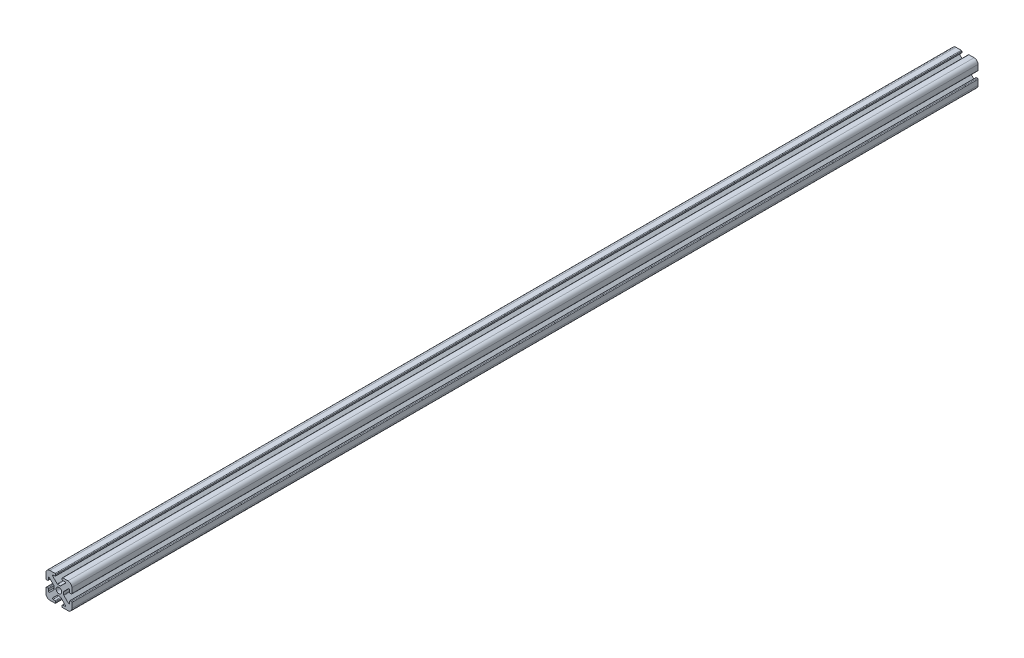
from build123d import *

# Parameters (mm, degrees)
SKETCH1_W           = 7.3
SKETCH1_H           = 7.3
SKETCH1_R           = 2.15
BOSS_EXTRUDE1_DEPTH = 700
BOSS_EXTRUDE2_DEPTH = 700
FILLET4_R           = 3
FILLET5_R           = 0.5
FILLET6_R           = 0.5
FILLET7_R           = 0.5
SKETCH3_R           = 2.15
CUT_EXTRUDE1_DEPTH  = 701.204486204
SKETCH4_R           = 2.15
CUT_EXTRUDE2_DEPTH  = 701.204486304
SKETCH5_R           = 2.15
CUT_EXTRUDE3_DEPTH  = 701.204486304
SKETCH6_R           = 2.15
CUT_EXTRUDE4_DEPTH  = 701.204486304


with BuildPart() as part:
    # Sketch1 → Boss-Extrude1 (new body)
    with BuildSketch(Plane.XY):
        Rectangle(SKETCH1_W, SKETCH1_H)
        Circle(SKETCH1_R, mode=Mode.SUBTRACT)
    extrude(amount=BOSS_EXTRUDE1_DEPTH)

    # Sketch2 → Boss-Extrude2 (add)
    with BuildSketch(Plane.XY):
        Polygon((3.65, 3.65), (1.2, 3.65), (5.750000001, 8.200000001), (2.500000001, 8.200000001), (2.500000001, 10.000000001), (10.000000001, 10.000000001), (10.000000001, 2.500000001), (8.200000001, 2.500000001), (8.200000001, 5.750000001), (3.65, 1.2), align=None)
        Polygon((-3.65, 3.65), (-1.2, 3.65), (-5.750000001, 8.200000001), (-2.500000001, 8.200000001), (-2.500000001, 10.000000001), (-10.000000001, 10.000000001), (-10.000000001, 2.500000001), (-8.200000001, 2.500000001), (-8.200000001, 5.750000001), (-3.65, 1.2), align=None)
        Polygon((-3.65, -3.65), (-3.65, -1.2), (-8.200000001, -5.750000001), (-8.200000001, -2.500000001), (-10.000000001, -2.500000001), (-10.000000001, -10.000000001), (-2.500000001, -10.000000001), (-2.500000001, -8.200000001), (-5.750000001, -8.200000001), (-1.2, -3.65), align=None)
        Polygon((3.65, -3.65), (3.65, -1.2), (8.200000001, -5.750000001), (8.200000001, -2.500000001), (10.000000001, -2.500000001), (10.000000001, -10.000000001), (2.500000001, -10.000000001), (2.500000001, -8.200000001), (5.750000001, -8.200000001), (1.2, -3.65), align=None)
    extrude(amount=BOSS_EXTRUDE2_DEPTH)

    # Fillet4
    fillet4_edges = [part.edges().sort_by_distance(p)[0] for p in [
        (10.000000001, 10.000000001, 350),
        (-10.000000001, 10.000000001, 350),
        (-10.000000001, -10.000000001, 350),
        (10.000000001, -10.000000001, 350),
    ]]
    fillet(fillet4_edges, radius=FILLET4_R)

    # Fillet5
    fillet5_edges = [part.edges().sort_by_distance(p)[0] for p in [
        (8.200000001, 2.500000001, 350),
        (10.000000001, 2.500000001, 350),
        (2.500000001, 10.000000001, 350),
        (2.500000001, 8.200000001, 350),
        (-2.500000001, 8.200000001, 350),
        (-2.500000001, 10.000000001, 350),
        (-10.000000001, 2.500000001, 350),
        (-8.200000001, 2.500000001, 350),
        (-8.200000001, -2.500000001, 350),
        (-10.000000001, -2.500000001, 350),
        (-2.500000001, -10.000000001, 350),
        (-2.500000001, -8.200000001, 350),
        (2.500000001, -8.200000001, 350),
        (10.000000001, -2.500000001, 350),
        (8.200000001, -2.500000001, 350),
    ]]
    fillet(fillet5_edges, radius=FILLET5_R)

    # Fillet6
    fillet6_edges = [part.edges().sort_by_distance(p)[0] for p in [
        (3.65, 1.2, 350),
        (1.2, 3.65, 350),
        (-3.65, 1.2, 350),
        (-1.2, 3.65, 350),
        (-1.2, -3.65, 350),
        (-3.65, -1.2, 350),
        (1.2, -3.65, 350),
        (3.65, -1.2, 350),
    ]]
    fillet(fillet6_edges, radius=FILLET6_R)

    # Fillet7
    fillet7_edges = [part.edges().sort_by_distance(p)[0] for p in [
        (8.200000001, 5.750000001, 350),
        (5.750000001, 8.200000001, 350),
        (-5.750000001, 8.200000001, 350),
        (-8.200000001, 5.750000001, 350),
        (-8.200000001, -5.750000001, 350),
        (-5.750000001, -8.200000001, 350),
        (5.750000001, -8.200000001, 350),
        (8.200000001, -5.750000001, 350),
    ]]
    fillet(fillet7_edges, radius=FILLET7_R)

    # Sketch3 → Cut-Extrude1 (cut, through all)
    with BuildSketch(Plane.ZY.offset(3.65)):
        with Locations(Location((10, 0, 0), (0, 0, 270))):
            Circle(SKETCH3_R)
    extrude(amount=-CUT_EXTRUDE1_DEPTH, mode=Mode.SUBTRACT)

    # Sketch4 → Cut-Extrude2 (cut, through all)
    with BuildSketch(Plane(origin=(3.65, 0, 0), x_dir=(0, 0, -1), z_dir=(1, 0, 0))):
        with Locations(Location((-10, 0, 0), (0, 0, 270))):
            Circle(SKETCH4_R)
    extrude(amount=-CUT_EXTRUDE2_DEPTH, mode=Mode.SUBTRACT)

    # Sketch5 → Cut-Extrude3 (cut, through all)
    with BuildSketch(Plane(origin=(3.65, 0, 0), x_dir=(0, 0, -1), z_dir=(1, 0, 0))):
        with Locations(Location((-690, 0, 0), (0, 0, 90))):
            Circle(SKETCH5_R)
    extrude(amount=-CUT_EXTRUDE3_DEPTH, mode=Mode.SUBTRACT)

    # Sketch6 → Cut-Extrude4 (cut, through all)
    with BuildSketch(Plane.ZY.offset(3.65)):
        with Locations(Location((690, 0, 0), (0, 0, 90))):
            Circle(SKETCH6_R)
    extrude(amount=-CUT_EXTRUDE4_DEPTH, mode=Mode.SUBTRACT)


solid = part.part
